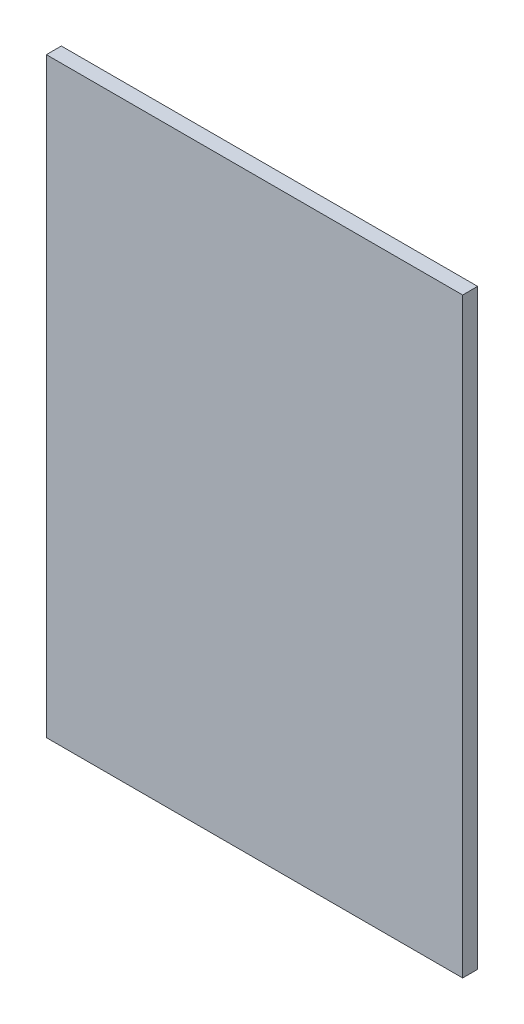
from build123d import *

# Parameters (mm, degrees)
CROQUIS1_W              = 139
CROQUIS1_H              = 197.5
SALIENTE_EXTRUIR1_DEPTH = 5


with BuildPart() as part:
    # Croquis1 → Saliente-Extruir1 (new body)
    with BuildSketch(Plane.XY):
        Rectangle(CROQUIS1_W, CROQUIS1_H)
    extrude(amount=SALIENTE_EXTRUIR1_DEPTH)


solid = part.part
